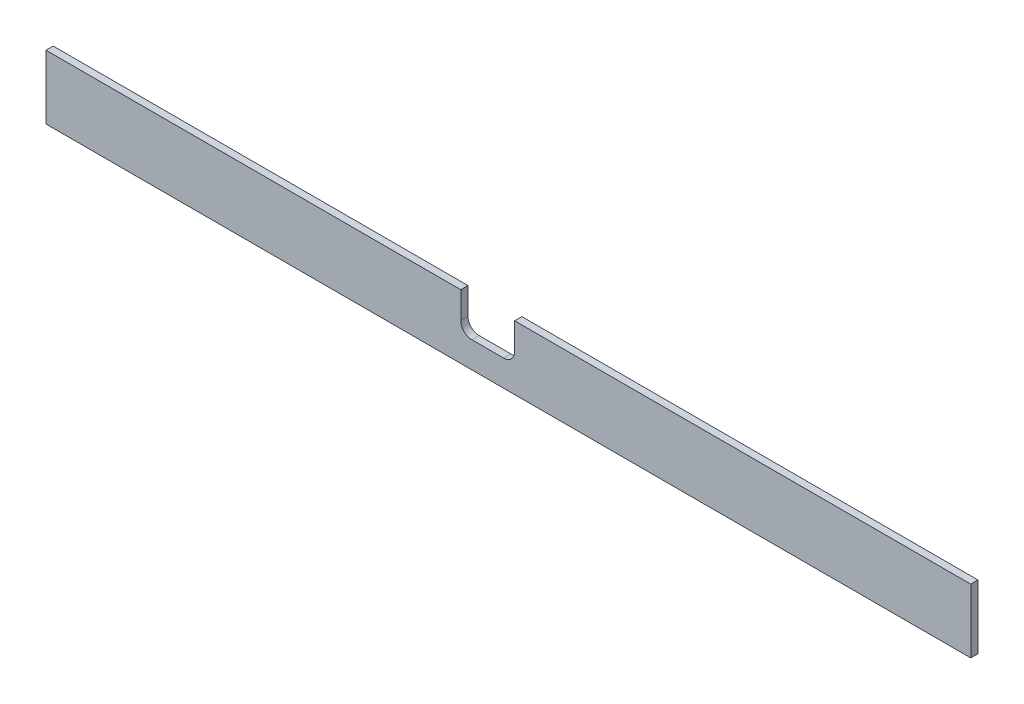
from build123d import *

# Parameters (mm, degrees)
ESQUISSE1_W             = 832
ESQUISSE1_H             = 57.5
BOSS_EXTRU_1_DEPTH      = 6.5
ENL_V_MAT_EXTRU_1_DEPTH = 418.042938437


with BuildPart() as part:
    # Esquisse1 → Boss.-Extru.1 (new body)
    with BuildSketch(Plane.XY):
        Rectangle(ESQUISSE1_W, ESQUISSE1_H)
    extrude(amount=BOSS_EXTRU_1_DEPTH)

    # Esquisse2 → Enlèv. mat.-Extru.1 (cut, through all)
    with BuildSketch(Plane(origin=(0, 0, 0), x_dir=(-1, 0, 0), z_dir=(0, 0, -1))):
        with BuildLine():
            Line((4.37, -5.25), (32.84397684, -5.25))
            ThreePointArc((32.84397684, -5.25), (39.915044651, -2.321067812), (42.84397684, 4.75))
            Line((42.84397684, 4.75), (42.84397684, 32.796121721))
            ThreePointArc((42.84397684, 32.796121721), (39.915044651, 39.867189532), (32.84397684, 42.796121721))
            Line((32.84397684, 42.796121721), (4.37, 42.796121721))
            ThreePointArc((4.37, 42.796121721), (-2.701067812, 39.867189532), (-5.63, 32.796121721))
            Line((-5.63, 32.796121721), (-5.63, 4.75))
            ThreePointArc((-5.63, 4.75), (-2.701067812, -2.321067812), (4.37, -5.25))
        make_face()
    extrude(amount=-ENL_V_MAT_EXTRU_1_DEPTH, mode=Mode.SUBTRACT)


solid = part.part
